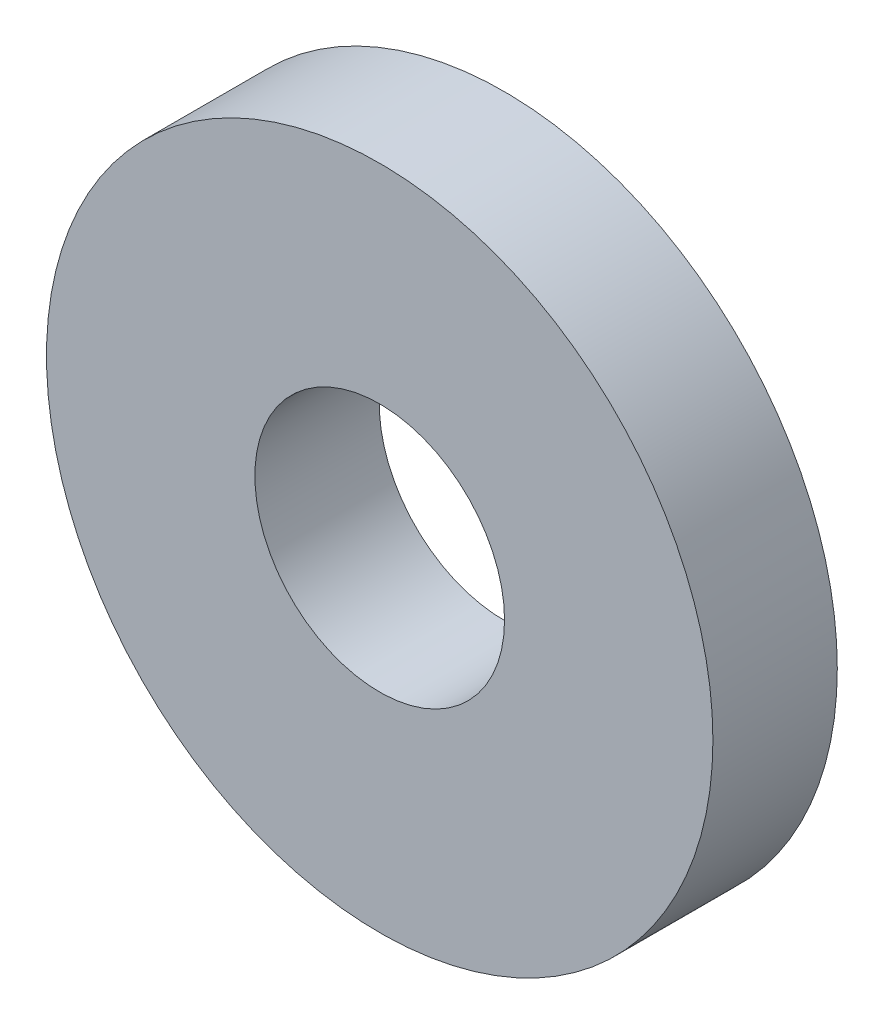
from build123d import *

# Parameters (mm, degrees)
SKETCH2_R           = 9.525
SKETCH2_R_2         = 3.5687
BOSS_EXTRUDE1_DEPTH = 1.778


with BuildPart() as part:
    # Sketch2 → Boss-Extrude1 (new, symmetric)
    with BuildSketch(Plane.XY):
        Circle(SKETCH2_R)
        Circle(SKETCH2_R_2, mode=Mode.SUBTRACT)
    extrude(amount=BOSS_EXTRUDE1_DEPTH, both=True)


solid = part.part
